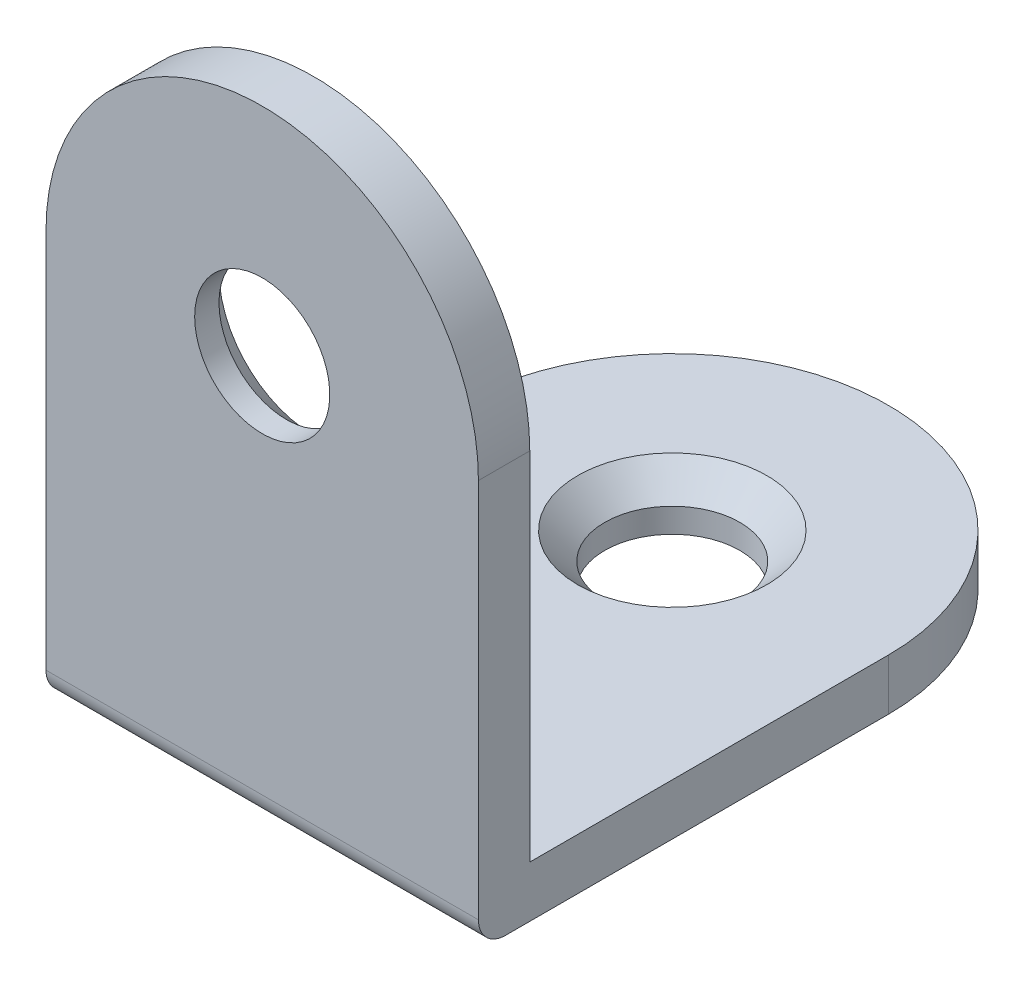
from build123d import *

# Parameters (mm, degrees)
SKETCH_1_R      = 2.5
EXTRUDE_1_DEPTH = 1.9
SKETCH_3_R      = 2.5
EXTRUDE_2_DEPTH = 1.9
FILLET_1_R      = 1
CHAMFER_1_SIZE  = 1


with BuildPart() as part:
    # 草图1 → 凸台-拉伸1 (new body)
    with BuildSketch(Plane.XY):
        with BuildLine():
            Line((0, 15.076269086), (0, 0))
            Line((0, 0), (16, 0))
            Line((16, 0), (16, 15.076269086))
            ThreePointArc((16, 15.076269086), (8, 23.076269086), (0, 15.076269086))
        make_face()
        with Locations(Location((8, 15.076269086, 0), (0, 0, 180))):
            Circle(SKETCH_1_R, mode=Mode.SUBTRACT)
    extrude(amount=EXTRUDE_1_DEPTH)

    # 草图3 → 凸台-拉伸2 (add)
    with BuildSketch(Plane(origin=(0, 0, 0), x_dir=(1, 0, 0), z_dir=(0, 1, 0))):
        with BuildLine():
            Line((0, -1.9), (16, -1.9))
            Line((16, -1.9), (16, 13.272714332))
            ThreePointArc((16, 13.272714332), (8, 21.272714332), (0, 13.272714332))
            Line((0, 13.272714332), (0, -1.9))
        make_face()
        with Locations(Location((8, 13.272714332, 0), (0, 0, 90))):
            Circle(SKETCH_3_R, mode=Mode.SUBTRACT)
    extrude(amount=EXTRUDE_2_DEPTH)

    # 圆角1
    fillet_1_edges = [part.edges().sort_by_distance(p)[0] for p in [
        (8, 0, 1.9),
    ]]
    fillet(fillet_1_edges, radius=FILLET_1_R)

    # 倒角1
    chamfer_1_edges = [part.edges().sort_by_distance(p)[0] for p in [
        (8, 1.9, -10.772714332),
        (10.5, 15.076269086, 0),
    ]]
    chamfer(chamfer_1_edges, length=CHAMFER_1_SIZE)


solid = part.part
